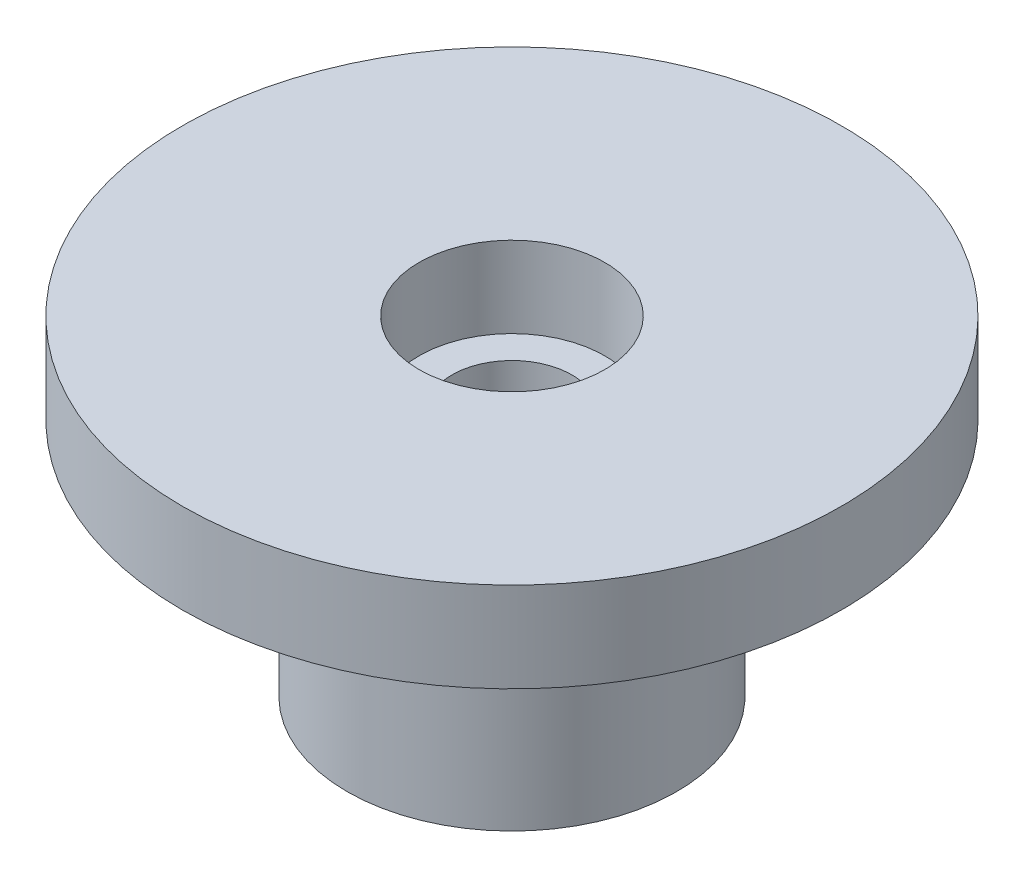
from build123d import *

# Parameters (mm, degrees)
SKETCH_1_R          = 11
EXTRUDE_3_DEPTH     = 11
SKETCH_1_10_R       = 11
SKETCH_1_10_R_2     = 5.5
CUT_EXTRUDE_1_DEPTH = 8
SKETCH_2_R          = 2
CUT_EXTRUDE_2_DEPTH = 27.944387171
SKETCH_2_3_R        = 3.1
CUT_EXTRUDE_3_DEPTH = 2.7
CUT_EXTRUDE_START   = -19.3
SKETCH_2_4_R        = 3.1
CUT_EXTRUDE_4_DEPTH = 2.7
SKETCH_3_R          = 50
CUT_EXTRUDE_5_DEPTH = 20.052558883


with BuildPart() as part:
    # 草图1 → 凸台-拉伸3 (new, symmetric)
    with BuildSketch(Plane(origin=(0, 0, 0), x_dir=(1, 0, 0), z_dir=(0, 1, 0))):
        with Locations(Location((0, 0, 0), (0, 0, 270))):
            Circle(SKETCH_1_R)
    extrude(amount=EXTRUDE_3_DEPTH, both=True)

    # 草图1<10> → 切除-拉伸1 (cut, symmetric)
    with BuildSketch(Plane(origin=(0, 0, 0), x_dir=(1, 0, 0), z_dir=(0, 1, 0))):
        with Locations(Location((0, 0, 0), (0, 0, 270))):
            Circle(SKETCH_1_10_R)
        with Locations(Location((0, 0, 0), (0, 0, 270))):
            Circle(SKETCH_1_10_R_2, mode=Mode.SUBTRACT)
    extrude(amount=CUT_EXTRUDE_1_DEPTH, both=True, mode=Mode.SUBTRACT)

    # 草图2 → 切除-拉伸2 (cut, through all)
    with BuildSketch(Plane(origin=(0, 11, 0), x_dir=(1, 0, 0), z_dir=(0, 1, 0))):
        with Locations(Location((0, 0, 0), (0, 0, 270))):
            Circle(SKETCH_2_R)
    extrude(amount=-CUT_EXTRUDE_2_DEPTH, mode=Mode.SUBTRACT)

    # 草图2<3> → 切除-拉伸3 (cut)
    with BuildSketch(Plane(origin=(0, 11, 0), x_dir=(1, 0, 0), z_dir=(0, 1, 0))):
        with Locations(Location((0, 0, 0), (0, 0, 270))):
            Circle(SKETCH_2_3_R)
    extrude(amount=-CUT_EXTRUDE_3_DEPTH, mode=Mode.SUBTRACT)

    # 草图2<4> → 切除-拉伸4 (cut)
    with BuildSketch(Plane(origin=(0, 11, 0), x_dir=(1, 0, 0), z_dir=(0, 1, 0)).offset(CUT_EXTRUDE_START)):
        with Locations(Location((0, 0, 0), (0, 0, 270))):
            Circle(SKETCH_2_4_R)
    extrude(amount=-CUT_EXTRUDE_4_DEPTH, mode=Mode.SUBTRACT)

    # 草图3 → 切除-拉伸5 (cut, through all)
    with BuildSketch(Plane(origin=(0, 0, 0), x_dir=(1, 0, 0), z_dir=(0, 1, 0))):
        Circle(SKETCH_3_R)
    extrude(amount=-CUT_EXTRUDE_5_DEPTH, mode=Mode.SUBTRACT)


solid = part.part
